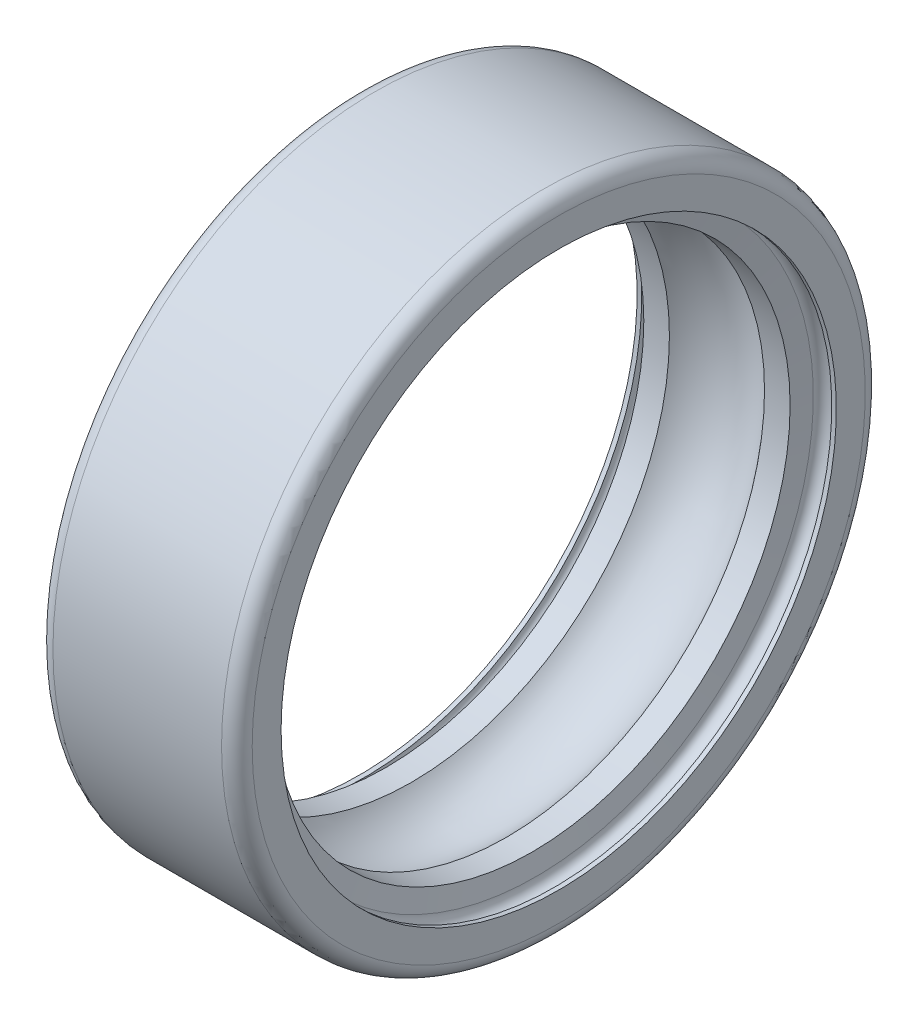
from build123d import *


with BuildPart() as part:
    # Sketch1 → Revolução1 (revolve)
    with BuildSketch(Plane.XY, mode=Mode.PRIVATE) as revolu_o1_sk:
        with BuildLine():
            Line((0, 18.115), (0.3, 18.115))
            ThreePointArc((0.3, 18.115), (0.9, 18.715), (1.5, 18.115))
            Line((1.5, 18.115), (1.727461805, 16.825))
            Line((1.727461805, 16.825), (3.397205131, 16.825))
            ThreePointArc((3.397205131, 16.825), (6.5, 18.319), (9.602794869, 16.825))
            Line((9.602794869, 16.825), (11.272538195, 16.825))
            Line((11.272538195, 16.825), (11.5, 18.115))
            ThreePointArc((11.5, 18.115), (12.1, 18.715), (12.7, 18.115))
            Line((12.7, 18.115), (13, 18.115))
            Line((13, 18.115), (13, 20))
            ThreePointArc((13, 20), (12.707106781, 20.707106781), (12, 21))
            Line((12, 21), (1, 21))
            ThreePointArc((1, 21), (0.292893219, 20.707106781), (0, 20))
            Line((0, 20), (0, 18.115))
        make_face()
    revolve(revolu_o1_sk.sketch.rotate(Axis((50, 0, 0), (-1, 0, 0)), 270), axis=Axis((50, 0, 0), (-1, 0, 0)))


solid = part.part
